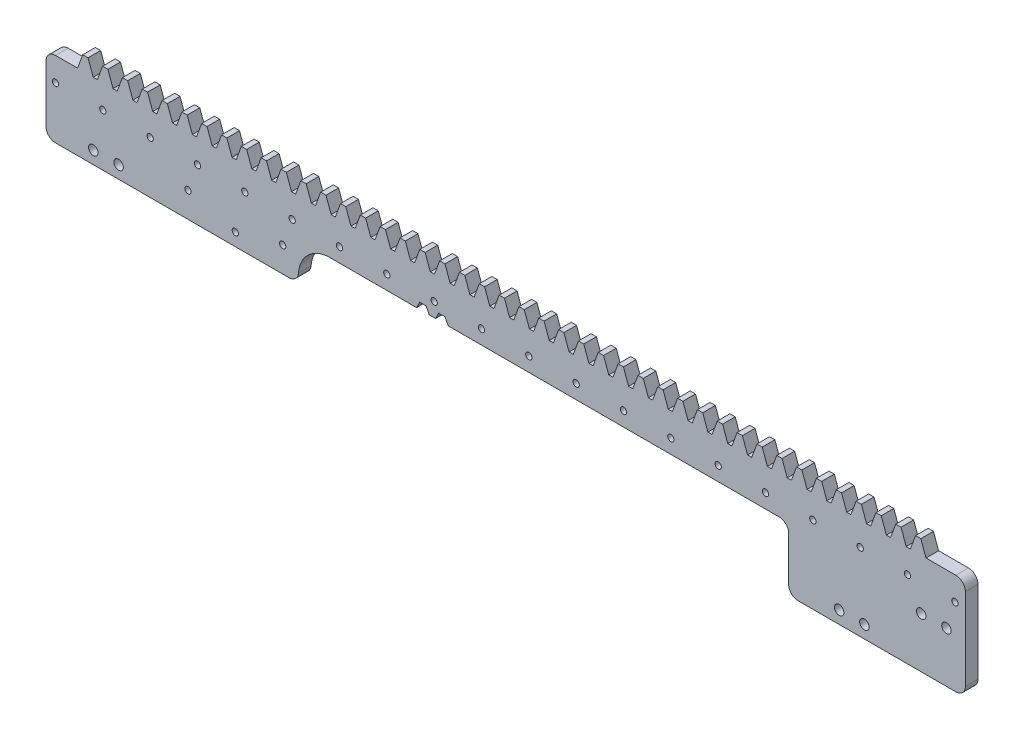
from build123d import *

# Parameters (mm, degrees)
SKETCH_1_W             = 271.32741229
SKETCH_1_H             = 12
EXTRUDE_1_DEPTH        = 4
EXTRUDE_2_DEPTH        = 4
PATTERN_LINEAR_1_COUNT = 43
PATTERN_LINEAR_1_PITCH = 6.283185307
SKETCH_4_R             = 1
CUT_EXTRUDE_1_DEPTH    = 10
SKETCH_8_R             = 1.5
SKETCH_8_R_2           = 1
EXTRUDE_3_DEPTH        = 4
FILLET_3_R             = 3
FILLET_4_R             = 10
CUT_EXTRUDE_2_DEPTH    = 10


with BuildPart() as part:
    # 草图1 → 拉伸1 (new body)
    with BuildSketch(Plane.XY):
        with Locations((135.663706145, -6)):
            Rectangle(SKETCH_1_W, SKETCH_1_H)
    extrude(amount=EXTRUDE_1_DEPTH)

    # 草图2 → 拉伸2 (add)
    with BuildSketch(Plane.XY.offset(4)):
        Polygon((0, 0), (1.637866054, 4.5), (3.323577771, 4.5), (4.961443825, 0), align=None)
    extrude_2 = extrude(amount=-EXTRUDE_2_DEPTH)

    # 阵列(线性)1: 拉伸2 ×43
    with Locations(*[(i * PATTERN_LINEAR_1_PITCH, 0, 0) for i in range(1, PATTERN_LINEAR_1_COUNT)]):
        add(extrude_2)

    # 草图4 → 切除-拉伸1 (cut)
    with BuildSketch(Plane.XY.offset(4)):
        with Locations((8, -7.5)):
            Circle(SKETCH_4_R)
        with Locations((23, -7.5)):
            Circle(SKETCH_4_R)
        with Locations((38, -7.5)):
            Circle(SKETCH_4_R)
        with Locations((53, -7.5)):
            Circle(SKETCH_4_R)
        with Locations((68, -7.5)):
            Circle(SKETCH_4_R)
        with Locations((83, -7.5)):
            Circle(SKETCH_4_R)
        with Locations((98, -7.5)):
            Circle(SKETCH_4_R)
        with Locations((113, -7.5)):
            Circle(SKETCH_4_R)
        with Locations((128, -7.5)):
            Circle(SKETCH_4_R)
        with Locations((143, -7.5)):
            Circle(SKETCH_4_R)
        with Locations((158, -7.5)):
            Circle(SKETCH_4_R)
        with Locations((173, -7.5)):
            Circle(SKETCH_4_R)
        with Locations((188, -7.5)):
            Circle(SKETCH_4_R)
        with Locations((203, -7.5)):
            Circle(SKETCH_4_R)
        with Locations((218, -7.5)):
            Circle(SKETCH_4_R)
        with Locations((233, -7.5)):
            Circle(SKETCH_4_R)
        with Locations((248, -7.5)):
            Circle(SKETCH_4_R)
        with Locations((263, -7.5)):
            Circle(SKETCH_4_R)
    extrude(amount=-CUT_EXTRUDE_1_DEPTH, mode=Mode.SUBTRACT)

    # 草图8 → 凸台-拉伸3 (add)
    # profile 1 of 2: a face of its own
    with BuildSketch(Plane.XY.offset(4)):
        Polygon((271.32741229, -12), (225.32741229, -12), (225.32741229, -32), (281.32741229, -32), (281.32741229, 0), (271.32741229, 0), align=None)
        with Locations((275.32741229, -16)):
            Circle(SKETCH_8_R, mode=Mode.SUBTRACT)
        with Locations((267.32741229, -16)):
            Circle(SKETCH_8_R, mode=Mode.SUBTRACT)
        with Locations((278, -7.5)):
            Circle(SKETCH_8_R_2, mode=Mode.SUBTRACT)
        with Locations((249.32741229, -28)):
            Circle(SKETCH_8_R, mode=Mode.SUBTRACT)
        with Locations((241.32741229, -28)):
            Circle(SKETCH_8_R, mode=Mode.SUBTRACT)
    # profile 2 of 2: a face of its own
    with BuildSketch(Plane.XY.offset(4)):
        Polygon((70, -12), (0, -12), (0, 0), (-10, 0), (-10, -24), (70, -24), align=None)
        with Locations((13, -20)):
            Circle(SKETCH_8_R, mode=Mode.SUBTRACT)
        with Locations((5, -20)):
            Circle(SKETCH_8_R, mode=Mode.SUBTRACT)
        with Locations((50, -20)):
            Circle(SKETCH_8_R_2, mode=Mode.SUBTRACT)
        with Locations((35, -16)):
            Circle(SKETCH_8_R_2, mode=Mode.SUBTRACT)
        with Locations((65, -16)):
            Circle(SKETCH_8_R_2, mode=Mode.SUBTRACT)
        with Locations((-7, -7.5)):
            Circle(SKETCH_8_R_2, mode=Mode.SUBTRACT)
    extrude(amount=-EXTRUDE_3_DEPTH)

    # 圆角3
    fillet_3_edges = [part.edges().sort_by_distance(p)[0] for p in [
        (225.32741229, -12, 2),
        (225.32741229, -32, 2),
        (281.32741229, 0, 2),
        (70, -24, 2),
        (-10, -24, 2),
        (-10, 0, 2),
        (281.32741229, -32, 2),
    ]]
    fillet(fillet_3_edges, radius=FILLET_3_R)

    # 圆角4
    fillet_4_edges = [part.edges().sort_by_distance(p)[0] for p in [
        (70, -12, 2),
    ]]
    fillet(fillet_4_edges, radius=FILLET_4_R)

    # 草图9 → 切除-拉伸2 (cut)
    with BuildSketch(Plane(origin=(0, 0, 0), x_dir=(-1, 0, 0), z_dir=(0, 0, -1))):
        Polygon((-117.436464788, -12), (-116.436464788, -10), (-114.436464788, -10), (-113.436464788, -12), align=None)
        Polygon((-110.436464788, -10), (-111.436464788, -12), (-107.436464788, -12), (-108.436464788, -10), align=None)
    extrude(amount=-CUT_EXTRUDE_2_DEPTH, mode=Mode.SUBTRACT)


solid = part.part
